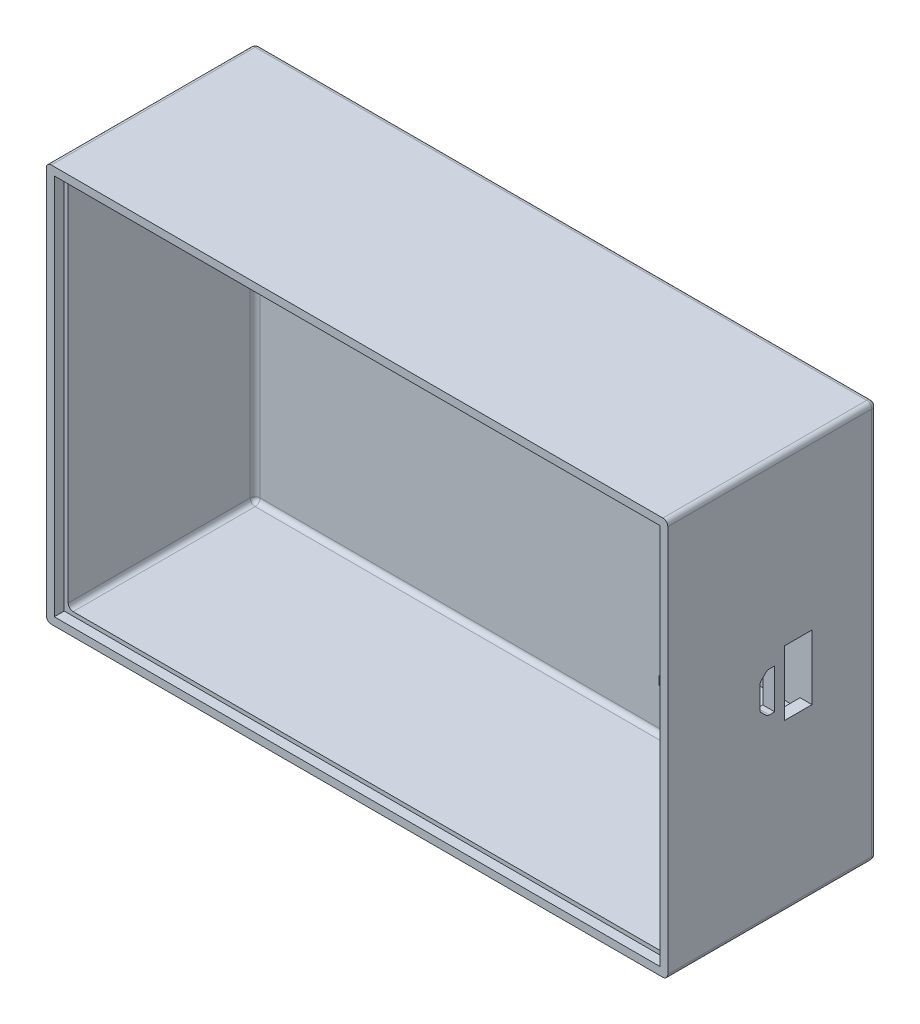
from build123d import *

# Parameters (mm, degrees)
SKETCH_1_W          = 125
SKETCH_1_H          = 80
EXTRUDE_1_DEPTH     = 40
SKETCH_2_W          = 120.2
SKETCH_2_H          = 75.2
CUT_EXTRUDE_1_DEPTH = 37.6
FILLET_1_R          = 1
FILLET_2_R          = 1
CUT_EXTRUDE_2_DEPTH = 0.5
SKETCH_4_W          = 5.5
SKETCH_4_H          = 13
CUT_EXTRUDE_3_DEPTH = 5
EXTRUDE_2_DEPTH     = 20
EXTRUDE_3_DEPTH     = 8
EXTRUDE_START       = 2
SKETCH_7_W          = 121.8
SKETCH_7_H          = 76.8
EXTRUDE_4_DEPTH     = 2


with BuildPart() as part:
    # Эскиз1 → Бобышка-Вытянуть1 (new body)
    with BuildSketch(Plane.XY):
        Rectangle(SKETCH_1_W, SKETCH_1_H)
    extrude(amount=EXTRUDE_1_DEPTH)

    # Эскиз2 → Вырез-Вытянуть1 (cut)
    with BuildSketch(Plane.XY.offset(40)):
        Rectangle(SKETCH_2_W, SKETCH_2_H)
    extrude(amount=-CUT_EXTRUDE_1_DEPTH, mode=Mode.SUBTRACT)

    # Скругление1
    fillet_1_edges = [part.edges().sort_by_distance(p)[0] for p in [
        (0, -40, 0),
        (-62.5, 0, 0),
        (0, 40, 0),
        (62.5, 0, 0),
        (62.5, -40, 20),
        (-62.5, -40, 20),
        (-62.5, 40, 20),
        (62.5, 40, 20),
    ]]
    fillet(fillet_1_edges, radius=FILLET_1_R)

    # Скругление2
    fillet_2_edges = [part.edges().sort_by_distance(p)[0] for p in [
        (60.1, 0, 2.4),
        (60.1, 37.6, 21.2),
        (0, -37.6, 2.4),
        (60.1, -37.6, 21.2),
        (-60.1, 0, 2.4),
        (-60.1, -37.6, 21.2),
        (0, 37.6, 2.4),
        (-60.1, 37.6, 21.2),
    ]]
    fillet(fillet_2_edges, radius=FILLET_2_R)

    # Эскиз3 → Вырез-Вытянуть2 (cut)
    # profile 1 of 6: a face of its own
    with BuildSketch(Plane(origin=(0, 0, 0), x_dir=(-1, 0, 0), z_dir=(0, 0, -1))):
        with BuildLine():
            Line((-35.743589744, 25), (-16.769230769, 25))
            Line((-16.769230769, 25), (-16.769230769, 8.333333333))
            Line((-16.769230769, 8.333333333), (-14.461538462, 8.333333333))
            Line((-14.461538462, 8.333333333), (-14.461538462, 0.641025641))
            Line((-14.461538462, 0.641025641), (-19.076923077, 0.641025641))
            Line((-19.076923077, 0.641025641), (-19.076923077, 5))
            Line((-19.076923077, 5), (-36.256410256, 5))
            Line((-36.256410256, 5), (-36.256410256, 0.641025641))
            Line((-36.256410256, 0.641025641), (-40.871794872, 0.641025641))
            Line((-40.871794872, 0.641025641), (-40.871794872, 8.333333333))
            Line((-40.871794872, 8.333333333), (-38.564102564, 8.333333333))
            add(Edge.make_bspline(
                [(-38.564102564, 8.333333333), (-38.423939227, 8.549412333), (-38.142564623, 8.983185846), (-37.766294395, 9.665700543), (-37.432031298, 10.377061568), (-37.124908802, 11.109271034), (-36.861959465, 11.86880581), (-36.632590424, 12.652158986), (-36.440496869, 13.462613095), (-36.284618524, 14.305421659), (-36.158953799, 15.1895625), (-36.044974298, 16.123005325), (-35.956693481, 17.113449057), (-35.874111033, 18.158890462), (-35.81488608, 19.259665772), (-35.777871569, 20.41649224), (-35.746447147, 21.629106486), (-35.744556365, 22.457242257), (-35.743589744, 22.880608974)],
                knots=[0, 0, 0, 0, 0.821752742, 1.649649308, 2.484634787, 3.329137309, 4.182327301, 5.048164878, 5.93303002, 6.839131783, 7.782388066, 8.782543542, 9.83977442, 10.955378249, 12.129129161, 13.357281614, 14.648966693, 16, 16, 16, 16], degree=3))
            Line((-35.743589744, 22.880608974), (-35.743589744, 25))
        make_face()
        with BuildLine():
            add(Edge.make_bspline(
                [(-30.102564103, 21.666666667), (-30.105207991, 21.29271776), (-30.110411753, 20.556702847), (-30.141427896, 19.471929174), (-30.198903671, 18.424816315), (-30.272504924, 17.415920166), (-30.374193999, 16.446325596), (-30.491872073, 15.51592918), (-30.638063507, 14.625283032), (-30.799382741, 13.771919733), (-30.989770134, 12.957530565), (-31.195203978, 12.179846934), (-31.428955472, 11.442789154), (-31.67921883, 10.743548847), (-31.957780404, 10.085663181), (-32.252123153, 9.463377077), (-32.572763759, 8.880432264), (-32.807560893, 8.513739619), (-32.923076923, 8.333333333)],
                knots=[0, 0, 0, 0, 1.299711557, 2.558122435, 3.771311303, 4.944304467, 6.073539971, 7.159347729, 8.2032346, 9.21003606, 10.177197405, 11.109446499, 12.004918904, 12.86385847, 13.689704149, 14.486931871, 15.255597286, 16, 16, 16, 16], degree=3))
            Line((-32.923076923, 8.333333333), (-22.41025641, 8.333333333))
            Line((-22.41025641, 8.333333333), (-22.41025641, 21.666666667))
            Line((-22.41025641, 21.666666667), (-30.102564103, 21.666666667))
        make_face(mode=Mode.SUBTRACT)
    # profile 2 of 6: a face of its own
    with BuildSketch(Plane(origin=(0, 0, 0), x_dir=(-1, 0, 0), z_dir=(0, 0, -1))):
        with BuildLine():
            Line((-6.769230769, 19.615384615), (10.923076923, 19.615384615))
            Line((10.923076923, 19.615384615), (10.923076923, 5))
            Line((10.923076923, 5), (5.538461538, 5))
            Line((5.538461538, 5), (5.538461538, 16.794871795))
            Line((5.538461538, 16.794871795), (-1.384615385, 16.794871795))
            Line((-1.384615385, 16.794871795), (-1.384615385, 10.048076923))
            add(Edge.make_bspline(
                [(-1.384615385, 10.048076923), (-1.386370161, 9.841005653), (-1.38974751, 9.442463754), (-1.43061393, 8.870145363), (-1.494144698, 8.34584416), (-1.579398924, 7.868380094), (-1.695415169, 7.438246181), (-1.834985273, 7.055656363), (-1.996839462, 6.717891165), (-2.252556904, 6.348388821), (-2.599413454, 5.95961178), (-3.040930933, 5.569462975), (-3.506716493, 5.266068316), (-3.922573615, 5.087374577), (-4.279996587, 4.985410882), (-4.584520837, 4.923820444), (-4.925339923, 4.868085771), (-5.303339715, 4.819468858), (-5.719065582, 4.784317372), (-6.173424849, 4.761999434), (-6.66492972, 4.74448371), (-7.005591152, 4.743894614), (-7.181891026, 4.743589744)],
                knots=[0, 0, 0, 0, 1.340868013, 2.580715734, 3.713588199, 4.760277271, 5.719123454, 6.594782291, 7.395470463, 8.136727625, 9.497147129, 10.759921788, 11.942705723, 13.081801271, 13.675827936, 14.347571739, 15.09265399, 15.912271391, 16.815144, 17.793873759, 18.858280561, 20, 20, 20, 20], degree=3))
            add(Edge.make_bspline(
                [(-7.181891026, 4.743589744), (-7.415650966, 4.747392526), (-7.919565879, 4.755590162), (-8.726395682, 4.803139599), (-9.6373807, 4.875198272), (-10.277639615, 4.941163836), (-10.615384615, 4.975961538)],
                knots=[0, 0, 0, 0, 0.814839079, 1.756543752, 2.816547317, 4, 4, 4, 4], degree=3))
            Line((-10.615384615, 4.975961538), (-10.615384615, 7.632211538))
            add(Edge.make_bspline(
                [(-10.615384615, 7.632211538), (-10.573976604, 7.632599088), (-10.46839733, 7.633587234), (-10.274920677, 7.621528064), (-10.01169784, 7.616593056), (-9.812753781, 7.60861256), (-9.701923077, 7.604166667)],
                knots=[0, 0, 0, 0, 0.543558918, 1.385928807, 2.543714495, 4, 4, 4, 4], degree=3))
            add(Edge.make_bspline(
                [(-9.701923077, 7.604166667), (-9.567046398, 7.598670355), (-9.314677242, 7.588386148), (-8.959441482, 7.576196167), (-8.653612273, 7.567804294), (-8.465281239, 7.565258133), (-8.379807692, 7.564102564)],
                knots=[0, 0, 0, 0, 1.224593261, 2.291349178, 3.224533305, 4, 4, 4, 4], degree=3))
            add(Edge.make_bspline(
                [(-8.379807692, 7.564102564), (-8.291590958, 7.565426279), (-8.124143446, 7.567938873), (-7.887114826, 7.592227139), (-7.675268101, 7.629808654), (-7.492442649, 7.691413303), (-7.330943187, 7.760407834), (-7.202745141, 7.855983674), (-7.092779049, 7.959939288), (-7.013277733, 8.094684363), (-6.952603688, 8.265829128), (-6.902374207, 8.486265686), (-6.866005406, 8.765472969), (-6.829145485, 9.100603944), (-6.8024436, 9.494898751), (-6.782984025, 9.947747754), (-6.77124658, 10.459341107), (-6.769925485, 10.819972464), (-6.769230769, 11.009615385)],
                knots=[0, 0, 0, 0, 0.945825259, 1.795306607, 2.553808499, 3.246864566, 3.862134721, 4.426621001, 4.953312137, 5.474127026, 6.086053296, 6.895587344, 7.894276821, 9.104388665, 10.511727968, 12.131936209, 13.965925869, 16, 16, 16, 16], degree=3))
            Line((-6.769230769, 11.009615385), (-6.769230769, 19.615384615))
        make_face()
    # profile 3 of 6: a face of its own
    with BuildSketch(Plane(origin=(0, 0, 0), x_dir=(-1, 0, 0), z_dir=(0, 0, -1))):
        with BuildLine():
            Line((36.307692308, 19.615384615), (36.307692308, 5))
            Line((36.307692308, 5), (30.923076923, 5))
            Line((30.923076923, 5), (30.923076923, 10.897435897))
            Line((30.923076923, 10.897435897), (30.442307692, 10.897435897))
            add(Edge.make_bspline(
                [(30.442307692, 10.897435897), (30.307399621, 10.897151422), (30.046826075, 10.896601959), (29.670188735, 10.878786198), (29.321149692, 10.857179984), (28.999333026, 10.819720812), (28.705075449, 10.777158295), (28.437287536, 10.725270029), (28.1980981, 10.663527257), (27.910508572, 10.557392241), (27.557194418, 10.378942568), (27.133007286, 10.085344805), (26.686965142, 9.704754922), (26.39738786, 9.40826878), (26.243589744, 9.250801282)],
                knots=[0, 0, 0, 0, 1.033741574, 1.996661172, 2.889183176, 3.71311321, 4.478792633, 5.167252479, 5.802785083, 6.36939551, 7.51365449, 8.825117058, 10.313779961, 12, 12, 12, 12], degree=3))
            Line((26.243589744, 9.250801282), (25.931089744, 8.970352564))
            Line((25.931089744, 8.970352564), (22.521634615, 5))
            Line((22.521634615, 5), (16.051282051, 5))
            Line((16.051282051, 5), (19.869391026, 9.118589744))
            add(Edge.make_bspline(
                [(19.869391026, 9.118589744), (20.001762801, 9.261255835), (20.258115196, 9.537544298), (20.648290221, 9.919420288), (21.035634938, 10.247074836), (21.405655041, 10.535862655), (21.773494046, 10.768929021), (22.128906731, 10.958260179), (22.475435678, 11.10435537), (22.709047041, 11.162002517), (22.822115385, 11.189903846)],
                knots=[0, 0, 0, 0, 1.275536761, 2.470216209, 3.575314176, 4.599451856, 5.544004934, 6.42497539, 7.237685091, 8, 8, 8, 8], degree=3))
            add(Edge.make_bspline(
                [(22.822115385, 11.189903846), (22.641518472, 11.200241167), (22.288285741, 11.220460118), (21.773845596, 11.301149545), (21.282393179, 11.401534395), (20.81805521, 11.543209505), (20.37800364, 11.713617163), (19.969160249, 11.925493152), (19.580470911, 12.161093522), (19.222284482, 12.432368704), (18.899138247, 12.729511223), (18.619134069, 13.05196172), (18.376047618, 13.389995098), (18.185803336, 13.754766021), (18.028156058, 14.132619326), (17.928534492, 14.535482873), (17.854749614, 14.954564262), (17.849043353, 15.242711354), (17.846153846, 15.388621795)],
                knots=[0, 0, 0, 0, 1.197713301, 2.342628858, 3.446289809, 4.518324156, 5.55505531, 6.568031173, 7.564999682, 8.563027648, 9.539728277, 10.46776829, 11.388312886, 12.290779309, 13.187851591, 14.093478572, 15.034585495, 16, 16, 16, 16], degree=3))
            add(Edge.make_bspline(
                [(17.846153846, 15.388621795), (17.84986642, 15.506235897), (17.857186009, 15.73812003), (17.896227608, 16.080488652), (17.968262298, 16.410881405), (18.073773969, 16.726258135), (18.202255675, 17.029857481), (18.359145211, 17.320545393), (18.547830608, 17.596518448), (18.838471569, 17.944606589), (19.259410649, 18.338104616), (19.843541411, 18.72862787), (20.501337161, 19.041753739), (21.110327599, 19.222558711), (21.645005762, 19.336751114), (22.099600849, 19.412413265), (22.599513637, 19.475425061), (23.145997462, 19.527078884), (23.739177239, 19.566924409), (24.379122479, 19.592605917), (25.065544672, 19.61566154), (25.538438959, 19.615478974), (25.782852564, 19.615384615)],
                knots=[0, 0, 0, 0, 0.696101467, 1.37241099, 2.03580972, 2.693014292, 3.337361357, 3.984416181, 4.644133792, 5.311895028, 6.664837187, 8.03682209, 9.4542059, 10.958925535, 11.783473158, 12.688943128, 13.684762593, 14.764344718, 15.936519858, 17.202062861, 18.553896884, 20, 20, 20, 20], degree=3))
            Line((25.782852564, 19.615384615), (36.307692308, 19.615384615))
        make_face()
        with BuildLine():
            Line((30.923076923, 17.051282051), (27.076923077, 17.051282051))
            add(Edge.make_bspline(
                [(27.076923077, 17.051282051), (26.905996475, 17.048899722), (26.578760076, 17.044338788), (26.106606943, 17.033184254), (25.675641451, 16.992752503), (25.281631588, 16.953966909), (24.9285937, 16.889575039), (24.611175678, 16.828965569), (24.337725871, 16.735931207), (24.097316825, 16.6437899), (23.892923626, 16.527820601), (23.715280376, 16.40056762), (23.563194765, 16.254958495), (23.443354858, 16.087761874), (23.345189571, 15.906732234), (23.277389431, 15.707733437), (23.235972557, 15.491851364), (23.232545914, 15.342078774), (23.230769231, 15.264423077)],
                knots=[0, 0, 0, 0, 1.72653821, 3.305431345, 4.767069014, 6.097088554, 7.301057069, 8.390914795, 9.354829622, 10.213874238, 10.986759081, 11.720527595, 12.416772168, 13.101956177, 13.789789786, 14.489292424, 15.216712155, 16, 16, 16, 16], degree=3))
            add(Edge.make_bspline(
                [(23.230769231, 15.264423077), (23.234066472, 15.186774114), (23.24048918, 15.03552144), (23.283967448, 14.817271269), (23.361319764, 14.616667262), (23.471675391, 14.43534563), (23.609450095, 14.267853127), (23.780302633, 14.120617549), (23.977909147, 13.98586699), (24.21172281, 13.875246803), (24.476496024, 13.774402013), (24.781436543, 13.691357307), (25.124210356, 13.621164406), (25.505024382, 13.560392522), (25.923798032, 13.518284817), (26.380747422, 13.486536424), (26.877767111, 13.46659453), (27.222470584, 13.463266428), (27.401442308, 13.461538462)],
                knots=[0, 0, 0, 0, 0.738505747, 1.438537798, 2.106124022, 2.772742729, 3.449332141, 4.160342169, 4.910768808, 5.717464319, 6.613971556, 7.603314207, 8.719416959, 9.941122083, 11.269570315, 12.721237693, 14.297650627, 16, 16, 16, 16], degree=3))
            Line((27.401442308, 13.461538462), (30.923076923, 13.461538462))
            Line((30.923076923, 13.461538462), (30.923076923, 17.051282051))
        make_face(mode=Mode.SUBTRACT)
    # profile 4 of 6: a face of its own
    with BuildSketch(Plane(origin=(0, 0, 0), x_dir=(-1, 0, 0), z_dir=(0, 0, -1))):
        with BuildLine():
            Line((-34.717948718, -13.435897436), (-40.358974359, -12.41025641))
            add(Edge.make_bspline(
                [(-40.358974359, -12.41025641), (-40.279888714, -12.212281851), (-40.123180431, -11.819995065), (-39.824596185, -11.264789738), (-39.473257502, -10.748721575), (-39.071886882, -10.269382885), (-38.615068822, -9.832608888), (-38.112910799, -9.428726776), (-37.555504013, -9.068543612), (-36.950048281, -8.743834924), (-36.291523478, -8.459016914), (-35.583204479, -8.211470242), (-34.823441259, -8.00531936), (-34.014729969, -7.831199531), (-33.153988448, -7.702683564), (-32.242502948, -7.605647167), (-31.279796888, -7.550450104), (-30.620794788, -7.542525399), (-30.282852564, -7.538461538)],
                knots=[0, 0, 0, 0, 0.854963274, 1.694110579, 2.523498924, 3.356480554, 4.197849411, 5.055696551, 5.938603418, 6.856874247, 7.809648952, 8.814687402, 9.865160438, 10.966677751, 12.132340193, 13.355597085, 14.64392632, 16, 16, 16, 16], degree=3))
            add(Edge.make_bspline(
                [(-30.282852564, -7.538461538), (-29.886140206, -7.543327819), (-29.116143664, -7.552772997), (-27.997901433, -7.618209544), (-26.955224811, -7.739470356), (-25.986985253, -7.899852711), (-25.095936172, -8.112834478), (-24.277433799, -8.364925409), (-23.537251789, -8.675528927), (-22.871834144, -9.02543604), (-22.287338367, -9.412388921), (-21.772813101, -9.811748302), (-21.339189582, -10.23250413), (-20.978426207, -10.667325297), (-20.704840189, -11.123900015), (-20.502714606, -11.594339884), (-20.382928814, -12.085145966), (-20.366979876, -12.418974385), (-20.358974359, -12.586538462)],
                knots=[0, 0, 0, 0, 1.560831493, 3.029486796, 4.404656358, 5.689125062, 6.888349997, 8.006716197, 9.054738793, 10.041923272, 10.960020323, 11.809342296, 12.600783475, 13.332767086, 14.025711206, 14.687350788, 15.341120049, 16, 16, 16, 16], degree=3))
            add(Edge.make_bspline(
                [(-20.358974359, -12.586538462), (-20.361337627, -12.701638042), (-20.366038518, -12.93058812), (-20.425728987, -13.267345057), (-20.515382796, -13.595333055), (-20.632566215, -13.917726506), (-20.798631199, -14.226638168), (-20.988353184, -14.532584419), (-21.220311722, -14.825826159), (-21.485612679, -15.11118187), (-21.787558943, -15.386059219), (-22.119902697, -15.656690099), (-22.492637343, -15.91129771), (-22.895298726, -16.165518825), (-23.339623606, -16.403309814), (-23.81465449, -16.641501272), (-24.328169129, -16.864052443), (-24.684103449, -17.002760293), (-24.866185897, -17.073717949)],
                knots=[0, 0, 0, 0, 0.814746678, 1.620651567, 2.414971373, 3.223538951, 4.044690925, 4.89535986, 5.771851774, 6.689232278, 7.6536808, 8.663137878, 9.723733213, 10.850255578, 12.03603721, 13.293018467, 14.615211302, 16, 16, 16, 16], degree=3))
            add(Edge.make_bspline(
                [(-24.866185897, -17.073717949), (-24.642551872, -17.131658106), (-24.205869802, -17.244795754), (-23.578112664, -17.446110324), (-22.992175464, -17.66164215), (-22.449180638, -17.892924114), (-21.95077366, -18.145040118), (-21.497166871, -18.417448588), (-21.086618975, -18.70733332), (-20.714897212, -19.010593311), (-20.390091893, -19.336418248), (-20.105499414, -19.678060634), (-19.870184027, -20.041539283), (-19.668033888, -20.419573496), (-19.523715731, -20.821847659), (-19.41414188, -21.238508906), (-19.342207847, -21.673265842), (-19.336324836, -21.970600609), (-19.333333333, -22.121794872)],
                knots=[0, 0, 0, 0, 1.363670452, 2.66278996, 3.890135407, 5.048615163, 6.145236149, 7.185059184, 8.169449617, 9.110314329, 10.013489942, 10.881676504, 11.73016355, 12.565953945, 13.406638985, 14.246177088, 15.108183796, 16, 16, 16, 16], degree=3))
            add(Edge.make_bspline(
                [(-19.333333333, -22.121794872), (-19.34219292, -22.338721231), (-19.359623789, -22.765514816), (-19.486158134, -23.389801465), (-19.699655411, -23.979815894), (-20.003479317, -24.535722537), (-20.384808741, -25.063023406), (-20.856483893, -25.554068042), (-21.410048049, -26.011750477), (-22.045952332, -26.436069992), (-22.763856152, -26.823231581), (-23.572827995, -27.146506025), (-24.457746674, -27.43329656), (-25.430352003, -27.656961645), (-26.483986126, -27.839018077), (-27.623277698, -27.955489165), (-28.844573529, -28.041589814), (-29.68706099, -28.04797905), (-30.122596154, -28.051282051)],
                knots=[0, 0, 0, 0, 0.761550587, 1.498319087, 2.226800592, 2.957091617, 3.716052601, 4.505611972, 5.341521545, 6.233879613, 7.186530315, 8.200336361, 9.2890326, 10.450538317, 11.701968329, 13.041876955, 14.470758718, 16, 16, 16, 16], degree=3))
            add(Edge.make_bspline(
                [(-30.122596154, -28.051282051), (-30.47922512, -28.048399954), (-31.172791318, -28.042794897), (-32.184367883, -27.993865829), (-33.137399769, -27.915524456), (-34.034333551, -27.803358598), (-34.873131887, -27.661663465), (-35.654354556, -27.485444483), (-36.377148558, -27.277753748), (-37.048641559, -27.038183079), (-37.672738835, -26.754372324), (-38.249594856, -26.409118161), (-38.790643325, -26.012474382), (-39.285470856, -25.55254762), (-39.74774232, -25.043665106), (-40.168053679, -24.477778506), (-40.546671206, -23.85275982), (-40.761891227, -23.407077863), (-40.871794872, -23.179487179)],
                knots=[0, 0, 0, 0, 1.358105267, 2.641220975, 3.855947254, 4.999023033, 6.082656065, 7.094392619, 8.047302311, 8.945029315, 9.807501762, 10.653577828, 11.500921721, 12.357601304, 13.221796556, 14.115914563, 15.037878278, 16, 16, 16, 16], degree=3))
            Line((-40.871794872, -23.179487179), (-35.230769231, -21.897435897))
            add(Edge.make_bspline(
                [(-35.230769231, -21.897435897), (-35.164864579, -22.040119435), (-35.036972508, -22.317005702), (-34.814744291, -22.701250926), (-34.582508183, -23.050670382), (-34.330222025, -23.359269716), (-34.061252106, -23.630105247), (-33.775832347, -23.859067351), (-33.475589585, -24.051480288), (-33.045322492, -24.254715491), (-32.455463654, -24.443407345), (-31.690741244, -24.599458273), (-30.851890457, -24.703206088), (-30.267159797, -24.712896899), (-29.962339744, -24.717948718)],
                knots=[0, 0, 0, 0, 0.879662781, 1.707040261, 2.48275382, 3.226747029, 3.935320759, 4.616203792, 5.271770941, 5.92733809, 7.275276667, 8.727274345, 10.293928337, 12, 12, 12, 12], degree=3))
            add(Edge.make_bspline(
                [(-29.962339744, -24.717948718), (-29.752607711, -24.716081473), (-29.34741697, -24.712474058), (-28.761517863, -24.672552788), (-28.219962365, -24.604443165), (-27.721504422, -24.514248792), (-27.267648765, -24.396277968), (-26.859942466, -24.245683633), (-26.491954415, -24.076684888), (-26.171812783, -23.87334195), (-25.889092423, -23.65828825), (-25.649755199, -23.426688897), (-25.437899403, -23.196594121), (-25.267641815, -22.954451306), (-25.138000643, -22.703265605), (-25.045081142, -22.444727275), (-24.986547665, -22.177803472), (-24.978436124, -21.996552113), (-24.974358974, -21.905448718)],
                knots=[0, 0, 0, 0, 1.589407083, 3.070646972, 4.447876576, 5.724383153, 6.907764151, 7.996500943, 9.015235275, 9.97012061, 10.86496701, 11.702630916, 12.491089718, 13.232400992, 13.938607157, 14.62696155, 15.309861917, 16, 16, 16, 16], degree=3))
            add(Edge.make_bspline(
                [(-24.974358974, -21.905448718), (-24.977185169, -21.800812842), (-24.982721604, -21.595834118), (-25.057033741, -21.298463192), (-25.163837937, -21.015305327), (-25.318548133, -20.746791529), (-25.522022155, -20.499046745), (-25.766027972, -20.264659447), (-26.050841997, -20.043795869), (-26.382146941, -19.843828141), (-26.756950734, -19.664570721), (-27.173878886, -19.502838344), (-27.639116601, -19.373945918), (-28.145430623, -19.260748798), (-28.698552892, -19.17857874), (-29.293548726, -19.119746255), (-29.933839129, -19.083141737), (-30.374949313, -19.07904464), (-30.603365385, -19.076923077)],
                knots=[0, 0, 0, 0, 0.720237758, 1.410925408, 2.102288907, 2.8040751, 3.53803513, 4.307024266, 5.134623217, 6.019637888, 6.971676192, 7.998466297, 9.100947845, 10.299346042, 11.576533089, 12.956493832, 14.424008909, 16, 16, 16, 16], degree=3))
            Line((-30.603365385, -19.076923077), (-31.897435897, -19.076923077))
            Line((-31.897435897, -19.076923077), (-31.897435897, -16.256410256))
            Line((-31.897435897, -16.256410256), (-31.260416667, -16.256410256))
            add(Edge.make_bspline(
                [(-31.260416667, -16.256410256), (-31.053371951, -16.254163917), (-30.652303845, -16.249812515), (-30.06912, -16.214628737), (-29.523538808, -16.15063126), (-29.015571754, -16.062395287), (-28.543382717, -15.956297153), (-28.10955251, -15.821818016), (-27.716184058, -15.655005569), (-27.356740735, -15.473621183), (-27.04071896, -15.263618195), (-26.761441834, -15.040934281), (-26.527379751, -14.797556202), (-26.330712732, -14.542186656), (-26.187161753, -14.263481765), (-26.076168964, -13.974266207), (-26.010242498, -13.665870219), (-26.003449891, -13.454903902), (-26, -13.34775641)],
                knots=[0, 0, 0, 0, 1.49029937, 2.886871774, 4.203260901, 5.442298604, 6.596583465, 7.685023486, 8.706224579, 9.669304773, 10.578486423, 11.432749348, 12.234962671, 13.00400541, 13.743647033, 14.482851238, 15.229456688, 16, 16, 16, 16], degree=3))
            add(Edge.make_bspline(
                [(-26, -13.34775641), (-26.002657045, -13.262006039), (-26.007898417, -13.092852173), (-26.062693177, -12.844395413), (-26.151326328, -12.607521106), (-26.273020507, -12.381463295), (-26.427682447, -12.164618374), (-26.622509455, -11.962580188), (-26.84674032, -11.76554819), (-27.104228296, -11.58164944), (-27.392348739, -11.411962923), (-27.715000963, -11.270323592), (-28.063833247, -11.144754497), (-28.443740911, -11.046212492), (-28.851598414, -10.965803586), (-29.29064645, -10.910454572), (-29.758891281, -10.879344098), (-30.081149732, -10.874357863), (-30.246794872, -10.871794872)],
                knots=[0, 0, 0, 0, 0.755897194, 1.491106475, 2.233369413, 2.982248597, 3.750996372, 4.576569761, 5.453718901, 6.382796318, 7.365372167, 8.399486862, 9.488193061, 10.634773957, 11.860034556, 13.155469815, 14.53787356, 16, 16, 16, 16], degree=3))
            add(Edge.make_bspline(
                [(-30.246794872, -10.871794872), (-30.525046884, -10.878791792), (-31.059003616, -10.892218658), (-31.820905554, -11.01278056), (-32.505985972, -11.210248997), (-33.112579876, -11.492918138), (-33.642114412, -11.856230487), (-34.089106085, -12.304751844), (-34.457900174, -12.833933767), (-34.629878846, -13.23203218), (-34.717948718, -13.435897436)],
                knots=[0, 0, 0, 0, 1.208751061, 2.319554717, 3.342564807, 4.298139982, 5.215927623, 6.118911266, 7.036698907, 8, 8, 8, 8], degree=3))
        make_face()
    # profile 5 of 6: a face of its own
    with BuildSketch(Plane(origin=(0, 0, 0), x_dir=(-1, 0, 0), z_dir=(0, 0, -1))):
        with BuildLine():
            Line((5.538461538, -20.358974359), (10.923076923, -21.641025641))
            add(Edge.make_bspline(
                [(10.923076923, -21.641025641), (10.81529284, -21.894182514), (10.602316992, -22.39440758), (10.209502766, -23.101079081), (9.769395007, -23.76078208), (9.274710933, -24.368887236), (8.726284423, -24.922721266), (8.130385764, -25.432019635), (7.480276617, -25.887854403), (6.778558823, -26.293771349), (6.028548068, -26.650981465), (5.226982721, -26.953172239), (4.380512144, -27.215056525), (3.483102818, -27.425054742), (2.539333377, -27.594899142), (1.544863591, -27.706984942), (0.503565425, -27.782201779), (-0.207925898, -27.790588399), (-0.571314103, -27.794871795)],
                knots=[0, 0, 0, 0, 0.947346957, 1.871909256, 2.78043276, 3.676452459, 4.567853774, 5.462099994, 6.373461405, 7.299076215, 8.251881505, 9.231922012, 10.247692588, 11.302232216, 12.405063169, 13.54924748, 14.748298777, 16, 16, 16, 16], degree=3))
            add(Edge.make_bspline(
                [(-0.571314103, -27.794871795), (-1.020371377, -27.788263465), (-1.900374344, -27.775313335), (-3.189268194, -27.641914822), (-4.417310043, -27.436394049), (-5.586875999, -27.149031652), (-6.692411397, -26.772728533), (-7.738187396, -26.313290823), (-8.722646169, -25.772706036), (-9.489182, -25.25034721), (-10.063213062, -24.796675284), (-10.46421467, -24.437892061), (-10.842333301, -24.068092336), (-11.185290816, -23.675873023), (-11.509188937, -23.277547156), (-11.79674912, -22.857059356), (-12.062660639, -22.425114423), (-12.299239976, -21.975257008), (-12.507045242, -21.51058088), (-12.688372592, -21.031882176), (-12.841432239, -20.536916696), (-12.963593763, -20.026725743), (-13.061840582, -19.501360142), (-13.126930322, -18.960618073), (-13.1749811, -18.404706105), (-13.177975942, -18.028686761), (-13.179487179, -17.838942308)],
                knots=[0, 0, 0, 0, 1.791237332, 3.510229671, 5.16418935, 6.756428933, 8.310109429, 9.818019681, 11.308628788, 12.785141417, 13.513323979, 14.226674063, 14.931293169, 15.622074919, 16.304481995, 16.97851566, 17.652970464, 18.327530513, 19.004925963, 19.682866128, 20.368863042, 21.070655585, 21.775093325, 22.500149618, 23.243155183, 24, 24, 24, 24], degree=3))
            add(Edge.make_bspline(
                [(-13.179487179, -17.838942308), (-13.177994221, -17.638520227), (-13.175044288, -17.242506874), (-13.127030177, -16.657207517), (-13.061192554, -16.087290861), (-12.965191896, -15.534789553), (-12.840681266, -14.999765615), (-12.688337376, -14.482028012), (-12.508150802, -13.980130694), (-12.299242377, -13.496598546), (-12.067617902, -13.027527323), (-11.800426566, -12.580900187), (-11.514658858, -12.144605776), (-11.189363138, -11.733702311), (-10.847526003, -11.331275915), (-10.473649574, -10.950155812), (-10.06968618, -10.589396427), (-9.499127495, -10.123172745), (-8.724126748, -9.597567618), (-7.732888216, -9.040531459), (-6.667700521, -8.575605295), (-5.534495436, -8.195649971), (-4.331057145, -7.899624825), (-3.058791077, -7.688631343), (-1.71694851, -7.564538493), (-0.799941642, -7.547285666), (-0.330929487, -7.538461538)],
                knots=[0, 0, 0, 0, 0.77664363, 1.53456768, 2.274892301, 2.999984421, 3.706925311, 4.403075492, 5.090802435, 5.772561366, 6.443923248, 7.116879817, 7.788800269, 8.463923535, 9.146684028, 9.834878389, 10.531317209, 11.245198673, 12.689680356, 14.15432575, 15.647051531, 17.187458641, 18.781957291, 20.445713313, 22.182125224, 24, 24, 24, 24], degree=3))
            add(Edge.make_bspline(
                [(-0.330929487, -7.538461538), (0.079234612, -7.545920299), (0.882111914, -7.560520479), (2.056397958, -7.658792905), (3.170546607, -7.833336156), (4.227473367, -8.065284509), (5.225083333, -8.375825904), (6.163932836, -8.751225104), (7.045823013, -9.194847745), (7.588806649, -9.549849993), (7.858173077, -9.725961538)],
                knots=[0, 0, 0, 0, 1.143684331, 2.238709315, 3.282544038, 4.286232804, 5.25321281, 6.192249358, 7.10320072, 8, 8, 8, 8], degree=3))
            add(Edge.make_bspline(
                [(7.858173077, -9.725961538), (8.01105294, -9.836969592), (8.317110581, -10.059202019), (8.740548416, -10.437684201), (9.135425873, -10.850117433), (9.506412255, -11.29437436), (9.841576261, -11.779979349), (10.144581056, -12.300546434), (10.430796481, -12.849622639), (10.58709688, -13.238120169), (10.666666667, -13.435897436)],
                knots=[0, 0, 0, 0, 0.959372778, 1.920615073, 2.880323673, 3.858489671, 4.857885176, 5.873727477, 6.917552015, 8, 8, 8, 8], degree=3))
            Line((10.666666667, -13.435897436), (5.282051282, -14.205128205))
            add(Edge.make_bspline(
                [(5.282051282, -14.205128205), (5.237718519, -14.078629948), (5.149698829, -13.827476248), (4.975399199, -13.468787551), (4.767365777, -13.13171712), (4.522818976, -12.817653932), (4.25209374, -12.518374711), (3.938702006, -12.247648427), (3.599305249, -11.988148184), (3.222469204, -11.759406292), (2.820949592, -11.550649265), (2.397628263, -11.365551348), (1.950735875, -11.21403121), (1.483173256, -11.090752041), (0.995578124, -10.988336248), (0.484968036, -10.92435963), (-0.04421476, -10.876019539), (-0.40426051, -10.873218943), (-0.587339744, -10.871794872)],
                knots=[0, 0, 0, 0, 0.889498384, 1.76603865, 2.642130213, 3.514804097, 4.406024819, 5.317012614, 6.260567101, 7.240067246, 8.23959494, 9.264297334, 10.304726928, 11.369512207, 12.473887005, 13.61016531, 14.784795815, 16, 16, 16, 16], degree=3))
            add(Edge.make_bspline(
                [(-0.587339744, -10.871794872), (-0.839984004, -10.875623477), (-1.333128113, -10.883096648), (-2.054188853, -10.964406562), (-2.739825395, -11.07977313), (-3.389164767, -11.252542065), (-3.998884287, -11.479099888), (-4.576874528, -11.74591799), (-5.114686119, -12.069510872), (-5.61873797, -12.436459126), (-6.075890079, -12.860384378), (-6.466506874, -13.353172632), (-6.802327831, -13.902475841), (-7.074019119, -14.514254313), (-7.280769125, -15.187443868), (-7.433592223, -15.91937315), (-7.519065924, -16.713792899), (-7.531862239, -17.263156998), (-7.538461538, -17.546474359)],
                knots=[0, 0, 0, 0, 1.101135447, 2.149340177, 3.160311962, 4.130706059, 5.073989307, 5.993572482, 6.902361748, 7.806156036, 8.708373151, 9.611435522, 10.539223606, 11.508883602, 12.521849135, 13.604522201, 14.764607206, 16, 16, 16, 16], degree=3))
            add(Edge.make_bspline(
                [(-7.538461538, -17.546474359), (-7.534294945, -17.847239509), (-7.526254964, -18.427604725), (-7.43080801, -19.263307368), (-7.286096565, -20.033753933), (-7.07902361, -20.738161155), (-6.811279272, -21.376848613), (-6.480850468, -21.94607213), (-6.093281001, -22.45187045), (-5.640172209, -22.884497205), (-5.140596549, -23.25493376), (-4.607276454, -23.579632329), (-4.036990407, -23.85000153), (-3.432224287, -24.07778944), (-2.789922556, -24.247122539), (-2.11359739, -24.370935827), (-1.40249555, -24.449596853), (-0.916075135, -24.457499471), (-0.667467949, -24.461538462)],
                knots=[0, 0, 0, 0, 1.292726868, 2.494483508, 3.611725173, 4.660121096, 5.64567175, 6.582361598, 7.482918392, 8.376416499, 9.266531008, 10.15291422, 11.057052642, 11.976526345, 12.927957669, 13.909014194, 14.931306992, 16, 16, 16, 16], degree=3))
            add(Edge.make_bspline(
                [(-0.667467949, -24.461538462), (-0.483114859, -24.458019517), (-0.119225517, -24.451073572), (0.416656088, -24.409388335), (0.932488317, -24.326394455), (1.42781384, -24.21969053), (1.90566988, -24.084079438), (2.360054266, -23.911198658), (2.796889731, -23.709679035), (3.212855584, -23.477948335), (3.607671195, -23.215470171), (3.969827684, -22.910239051), (4.308224255, -22.575159578), (4.611793625, -22.199264402), (4.891547516, -21.791994903), (5.138192713, -21.347465428), (5.355851116, -20.866958976), (5.476683805, -20.5308273), (5.538461538, -20.358974359)],
                knots=[0, 0, 0, 0, 1.1029479, 2.177077609, 3.212079838, 4.225930326, 5.206987281, 6.180370042, 7.13116421, 8.082495246, 9.026417573, 9.962361276, 10.911408523, 11.870922843, 12.848133906, 13.863871214, 14.907868427, 16, 16, 16, 16], degree=3))
        make_face()
    # profile 6 of 6: a face of its own
    with BuildSketch(Plane(origin=(0, 0, 0), x_dir=(-1, 0, 0), z_dir=(0, 0, -1))):
        with BuildLine():
            Line((15.41025641, -7.794871795), (21.748397436, -7.794871795))
            Line((21.748397436, -7.794871795), (28.310897436, -17.758814103))
            Line((28.310897436, -17.758814103), (33.350961538, -7.794871795))
            Line((33.350961538, -7.794871795), (39.512820513, -7.794871795))
            Line((39.512820513, -7.794871795), (30.117788462, -22.999198718))
            add(Edge.make_bspline(
                [(30.117788462, -22.999198718), (29.992209817, -23.200347754), (29.746967868, -23.593170768), (29.365167852, -24.156068006), (28.980281927, -24.680170575), (28.596473481, -25.171274028), (28.207105196, -25.622835091), (27.820488883, -26.042295889), (27.425595935, -26.417486711), (27.033106201, -26.764782101), (26.619856016, -27.067000287), (26.186173879, -27.336034792), (25.718443171, -27.555096654), (25.223017781, -27.734528279), (24.700207428, -27.881711147), (24.147107323, -27.978166053), (23.566080793, -28.040748129), (23.169509709, -28.047713625), (22.966346154, -28.051282051)],
                knots=[0, 0, 0, 0, 1.232160985, 2.406281437, 3.533355889, 4.610685078, 5.644162742, 6.631087789, 7.573455428, 8.473717721, 9.352321608, 10.230678799, 11.121584392, 12.030498006, 12.966610129, 13.939874995, 14.944596977, 16, 16, 16, 16], degree=3))
            add(Edge.make_bspline(
                [(22.966346154, -28.051282051), (22.767356873, -28.050527069), (22.381359089, -28.049062559), (21.817688396, -28.037353529), (21.288929896, -28.015848871), (20.791690334, -27.995173079), (20.329934683, -27.956138907), (19.899158632, -27.919664577), (19.502851889, -27.865814649), (19.249666529, -27.825994209), (19.128205128, -27.806891026)],
                knots=[0, 0, 0, 0, 1.240388216, 2.406094951, 3.514044289, 4.539183369, 5.507735045, 6.402345096, 7.233552038, 8, 8, 8, 8], degree=3))
            Line((19.128205128, -27.806891026), (19.128205128, -24.665865385))
            add(Edge.make_bspline(
                [(19.128205128, -24.665865385), (19.488724158, -24.681562697), (20.172178471, -24.711320894), (20.856256967, -24.715821949), (21.179487179, -24.717948718)],
                knots=[0, 0, 0, 0, 1.054990869, 2, 2, 2, 2], degree=3))
            add(Edge.make_bspline(
                [(21.179487179, -24.717948718), (21.327782854, -24.716910371), (21.615313999, -24.714897116), (22.029639302, -24.685396458), (22.412647851, -24.64377227), (22.760400352, -24.579387943), (23.077188612, -24.50023493), (23.36012242, -24.400929818), (23.61277231, -24.285454693), (23.835657941, -24.144574391), (24.043227812, -23.975333517), (24.237680391, -23.7629762), (24.434665998, -23.514882612), (24.625358429, -23.223402005), (24.819485824, -22.894612681), (25.004505309, -22.520385738), (25.19535158, -22.107714631), (25.31033539, -21.813971192), (25.370192308, -21.661057692)],
                knots=[0, 0, 0, 0, 1.247011666, 2.417836479, 3.492055037, 4.485672522, 5.390151663, 6.235655022, 7.004487728, 7.721259572, 8.447561398, 9.250116621, 10.13776972, 11.109755632, 12.177022009, 13.347469597, 14.61917696, 16, 16, 16, 16], degree=3))
            Line((25.370192308, -21.661057692), (15.41025641, -7.794871795))
        make_face()
    extrude(amount=-CUT_EXTRUDE_2_DEPTH, mode=Mode.SUBTRACT)

    # Эскиз4 → Вырез-Вытянуть3 (cut)
    with BuildSketch(Plane(origin=(62.5, 0, 0), x_dir=(0, 0, -1), z_dir=(1, 0, 0))):
        with BuildLine():
            Line((-20.5, -4), (-20.5, 4))
            Line((-20.5, 4), (-21.585786438, 4))
            ThreePointArc((-21.585786438, 4), (-21.96846987, 3.923879533), (-22.292893219, 3.707106781))
            Line((-22.292893219, 3.707106781), (-23.207106781, 2.792893219))
            ThreePointArc((-23.207106781, 2.792893219), (-23.423879533, 2.46846987), (-23.5, 2.085786438))
            Line((-23.5, 2.085786438), (-23.5, -2.085786438))
            ThreePointArc((-23.5, -2.085786438), (-23.423879533, -2.46846987), (-23.207106781, -2.792893219))
            Line((-23.207106781, -2.792893219), (-22.292893219, -3.707106781))
            ThreePointArc((-22.292893219, -3.707106781), (-21.96846987, -3.923879533), (-21.585786438, -4))
            Line((-21.585786438, -4), (-20.5, -4))
        make_face()
        with Locations((-15.75, 0)):
            Rectangle(SKETCH_4_W, SKETCH_4_H)
    extrude(amount=-CUT_EXTRUDE_3_DEPTH, mode=Mode.SUBTRACT)

    # Эскиз5 → Бобышка-Вытянуть2 (add)
    with BuildSketch(Plane.ZY.offset(-60.1)):
        Polygon((11.4, 8.5), (11.4, -10.1), (21.4, -10.1), (21.4, -8.5), (13, -8.5), (13, 8.5), align=None)
    extrude(amount=EXTRUDE_2_DEPTH)

    # Эскиз6 → Бобышка-Вытянуть3 (add)
    with BuildSketch(Plane.XY.offset(13)):
        with BuildLine():
            Line((43.652577692, -1.5), (43.352577692, -1.5))
            ThreePointArc((43.352577692, -1.5), (43.175800997, -1.426776695), (43.102577692, -1.25))
            Line((43.102577692, -1.25), (43.102577692, 1.25))
            ThreePointArc((43.102577692, 1.25), (43.175800997, 1.426776695), (43.352577692, 1.5))
            Line((43.352577692, 1.5), (43.652577692, 1.5))
            ThreePointArc((43.652577692, 1.5), (43.829354388, 1.426776695), (43.902577692, 1.25))
            Line((43.902577692, 1.25), (43.902577692, -1.25))
            ThreePointArc((43.902577692, -1.25), (43.829354388, -1.426776695), (43.652577692, -1.5))
        make_face()
        with BuildLine():
            Line((45.983164599, 6.5), (43.983164599, 6.5))
            ThreePointArc((43.983164599, 6.5), (43.806387904, 6.573223305), (43.733164599, 6.75))
            Line((43.733164599, 6.75), (43.733164599, 7.05))
            ThreePointArc((43.733164599, 7.05), (43.806387904, 7.226776695), (43.983164599, 7.3))
            Line((43.983164599, 7.3), (45.983164599, 7.3))
            ThreePointArc((45.983164599, 7.3), (46.159941294, 7.226776695), (46.233164599, 7.05))
            Line((46.233164599, 7.05), (46.233164599, 6.75))
            ThreePointArc((46.233164599, 6.75), (46.159941294, 6.573223305), (45.983164599, 6.5))
        make_face()
    extrude(amount=EXTRUDE_3_DEPTH)

    # Эскиз7 → Бобышка-Вытянуть4 (add)
    with BuildSketch(Plane.XY.offset(40).offset(EXTRUDE_START)):
        with BuildLine():
            Line((-61.5, -40), (61.5, -40))
            ThreePointArc((61.5, -40), (62.207106781, -39.707106781), (62.5, -39))
            Line((62.5, -39), (62.5, 39))
            ThreePointArc((62.5, 39), (62.207106781, 39.707106781), (61.5, 40))
            Line((61.5, 40), (-61.5, 40))
            ThreePointArc((-61.5, 40), (-62.207106781, 39.707106781), (-62.5, 39))
            Line((-62.5, 39), (-62.5, -39))
            ThreePointArc((-62.5, -39), (-62.207106781, -39.707106781), (-61.5, -40))
        make_face()
        Rectangle(SKETCH_7_W, SKETCH_7_H, mode=Mode.SUBTRACT)
    extrude(amount=-EXTRUDE_4_DEPTH)


solid = part.part
